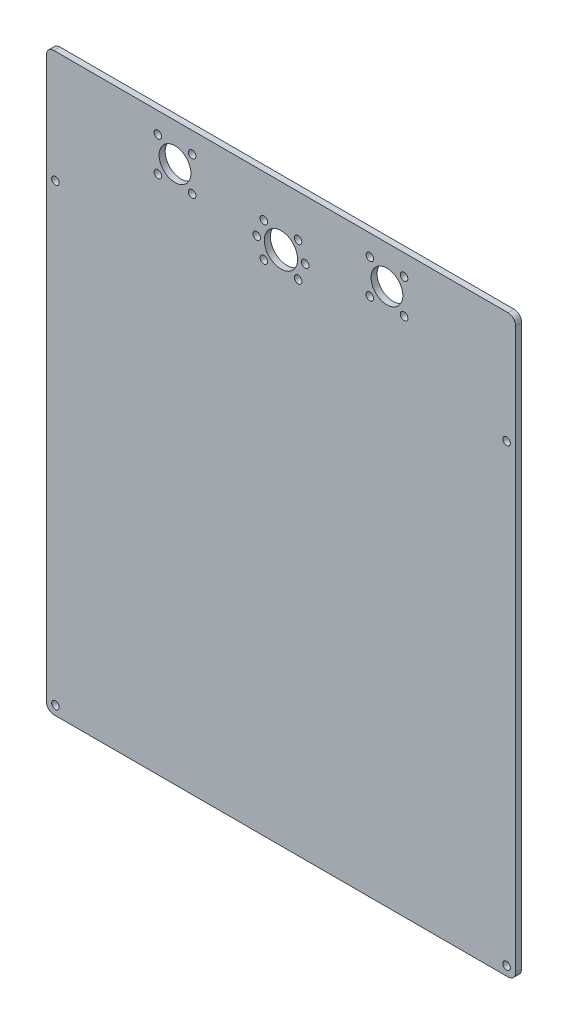
from build123d import *

# Parameters (mm, degrees)
ESQUISSE1_W             = 310
ESQUISSE1_H             = 380
BOSS_EXTRU_1_DEPTH      = 4
CONG_1_R                = 5
ESQUISSE3_R             = 10.5
ESQUISSE3_R_2           = 11
ESQUISSE3_R_3           = 2.5
ENL_V_MAT_EXTRU_1_DEPTH = 10


with BuildPart() as part:
    # Esquisse1 → Boss.-Extru.1 (new body)
    with BuildSketch(Plane.XY):
        with Locations((135.939300038, -172.787610619)):
            Rectangle(ESQUISSE1_W, ESQUISSE1_H)
    extrude(amount=BOSS_EXTRU_1_DEPTH)

    # Congé1
    cong_1_edges = [part.edges().sort_by_distance(p)[0] for p in [
        (-19.060699962, 17.212389381, 2),
        (290.939300038, 17.212389381, 2),
        (290.939300038, -362.787610619, 2),
        (-19.060699962, -362.787610619, 2),
    ]]
    fillet(cong_1_edges, radius=CONG_1_R)

    # Esquisse3 → Enlèv. mat.-Extru.1 (cut)
    with BuildSketch(Plane(origin=(0, 0, 0), x_dir=(-1, 0, 0), z_dir=(0, 0, -1))):
        with Locations((-205.939300038, -7.787610619)):
            Circle(ESQUISSE3_R)
        with Locations((-135.939300038, -21.787610619)):
            Circle(ESQUISSE3_R_2)
        with Locations((-65.939300038, -7.787610619)):
            Circle(ESQUISSE3_R)
        with Locations(Location((-217.253008537, 3.52609788, 0), (0, 0, 180))):
            Circle(ESQUISSE3_R_3)
        with Locations(Location((-194.625591539, 3.52609788, 0), (0, 0, 180))):
            Circle(ESQUISSE3_R_3)
        with Locations(Location((-194.625591539, -19.101319118, 0), (0, 0, 180))):
            Circle(ESQUISSE3_R_3)
        with Locations(Location((-217.253008537, -19.101319118, 0), (0, 0, 180))):
            Circle(ESQUISSE3_R_3)
        with Locations(Location((-77.253008537, 3.52609788, 0), (0, 0, 180))):
            Circle(ESQUISSE3_R_3)
        with Locations(Location((-54.625591539, 3.52609788, 0), (0, 0, 180))):
            Circle(ESQUISSE3_R_3)
        with Locations(Location((-54.625591539, -19.101319118, 0), (0, 0, 180))):
            Circle(ESQUISSE3_R_3)
        with Locations(Location((-77.253008537, -19.101319118, 0), (0, 0, 180))):
            Circle(ESQUISSE3_R_3)
        with Locations(Location((-119.939300038, -21.787610619, 0), (0, 0, 180))):
            Circle(ESQUISSE3_R_3)
        with Locations(Location((-124.625591539, -10.47390212, 0), (0, 0, 180))):
            Circle(ESQUISSE3_R_3)
        with Locations(Location((-124.625591539, -33.101319118, 0), (0, 0, 180))):
            Circle(ESQUISSE3_R_3)
        with Locations(Location((-147.253008537, -33.101319118, 0), (0, 0, 180))):
            Circle(ESQUISSE3_R_3)
        with Locations(Location((-151.939300038, -21.787610619, 0), (0, 0, 180))):
            Circle(ESQUISSE3_R_3)
        with Locations(Location((-147.253008537, -10.47390212, 0), (0, 0, 180))):
            Circle(ESQUISSE3_R_3)
        with Locations((13.060699962, -56.787610619)):
            Circle(ESQUISSE3_R_3)
        with Locations((13.060699962, -356.787610619)):
            Circle(ESQUISSE3_R_3)
        with Locations((-284.939300038, -356.787610619)):
            Circle(ESQUISSE3_R_3)
        with Locations((-284.939300038, -56.787610619)):
            Circle(ESQUISSE3_R_3)
    extrude(amount=-ENL_V_MAT_EXTRU_1_DEPTH, mode=Mode.SUBTRACT)


solid = part.part
